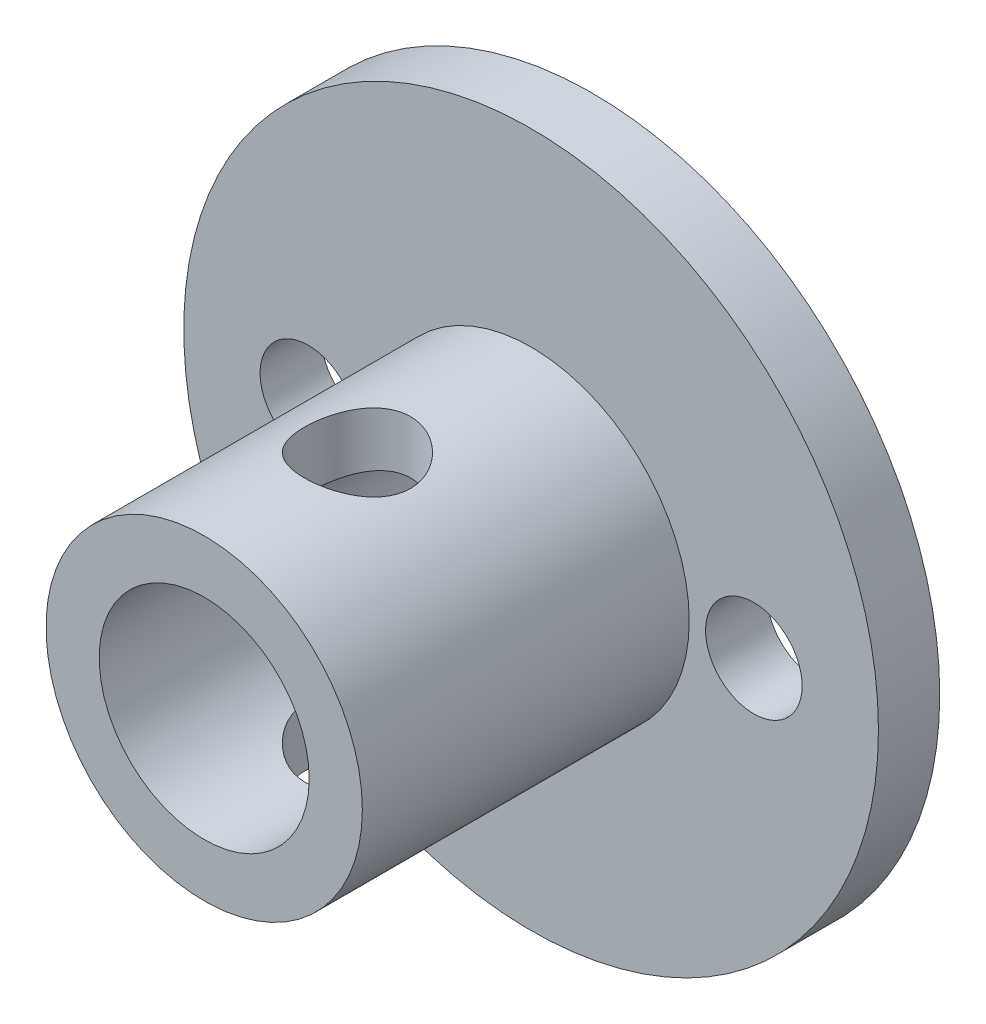
from build123d import *

# Parameters (mm, degrees)
CUT_EXTRUDE1_DEPTH      = 20.458372876
CUT_EXTRUDE1_DEPTH_BACK = 20.458372876
SKETCH2_R               = 1.651
CUT_EXTRUDE2_DEPTH      = 19.338201985
CUT_EXTRUDE2_DEPTH_BACK = 19.338201985
SKETCH3_R               = 1.5


with BuildPart() as part:
    # Sketch1 → Revolve1 (revolve)
    with BuildSketch(Plane(origin=(0, 0, 0), x_dir=(0, 0, -1), z_dir=(1, 0, 0))):
        Polygon((-1.905, 4.9149), (-12.065, 4.9149), (-12.065, 3.2639), (0, 3.2639), (0, 10.795), (-1.905, 10.795), align=None)
    revolve(axis=Axis((0, 0, 9.576838869), (0, 0, -1)))

    # Sketch2 → Cut-Extrude1 (cut, two sides: drawn at the far end of the back side and taken through both)
    with BuildSketch(Plane(origin=(0, 0, 0), x_dir=(1, 0, 0), z_dir=(0, 1, 0)).offset(-CUT_EXTRUDE1_DEPTH_BACK)):
        with Locations((0, -7.3025)):
            Circle(SKETCH2_R)
    extrude(amount=CUT_EXTRUDE1_DEPTH + CUT_EXTRUDE1_DEPTH_BACK, mode=Mode.SUBTRACT)

    # Sketch3 → Cut-Extrude2 (cut, two sides: drawn at the far end of the back side and taken through both)
    with BuildSketch(Plane.XY.offset(1.905).offset(-CUT_EXTRUDE2_DEPTH_BACK)):
        with Locations((-6.9229, 0)):
            Circle(SKETCH3_R)
        with Locations((6.9229, 0)):
            Circle(SKETCH3_R)
    extrude(amount=CUT_EXTRUDE2_DEPTH + CUT_EXTRUDE2_DEPTH_BACK, mode=Mode.SUBTRACT)


solid = part.part
